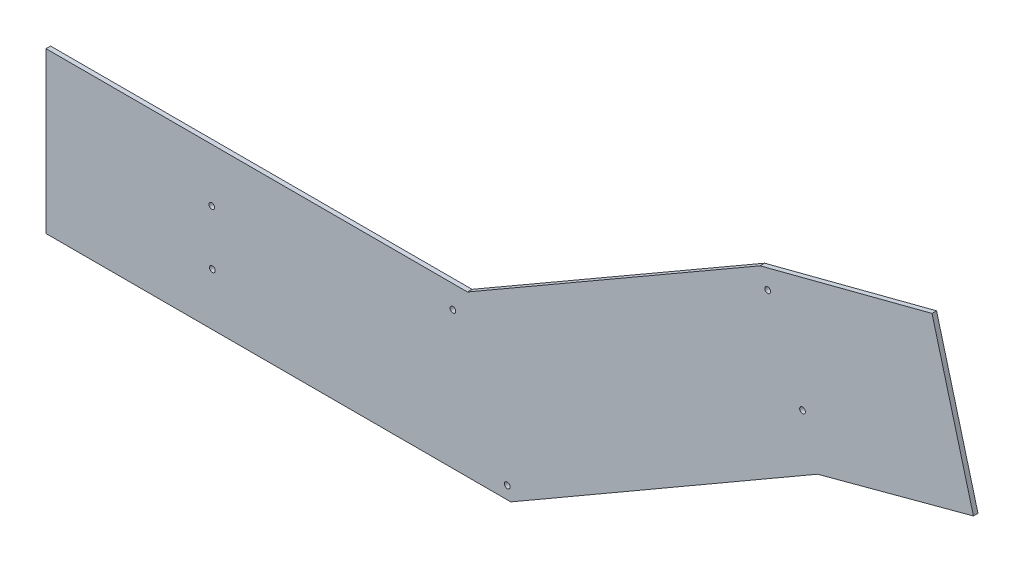
from build123d import *

# Parameters (mm, degrees)
MODEL_R            = 1
BOSS_EXTRU_1_DEPTH = 1.6


with BuildPart() as part:
    # Model → Boss.-Extru.1 (new body)
    with BuildSketch(Plane.XY):
        Polygon((98.150595456, 11.331634302), (152.811395456, 25.971686302), (138.282595456, 80.221514302), (78.010935456, 64.541586302), (-24.588554544, 5.301674302), (-151.608757489, 5.292943326), (-172.373873722, 5.291515997), (-172.373873722, -50.687645053), (-172.373873722, -50.858487698), (-9.398592544, -50.858487698), align=None)
        with Locations((-114.030844544, -32.493525698)):
            Circle(MODEL_R, mode=Mode.SUBTRACT)
        with Locations((-10.652844544, -46.438125698)):
            Circle(MODEL_R, mode=Mode.SUBTRACT)
        with Locations((-114.259444544, -13.418125698)):
            Circle(MODEL_R, mode=Mode.SUBTRACT)
        with Locations((-29.702844544, -2.648525698)):
            Circle(MODEL_R, mode=Mode.SUBTRACT)
        with Locations((92.877555456, 28.085474302)):
            Circle(MODEL_R, mode=Mode.SUBTRACT)
        with Locations((80.685555456, 58.489274302)):
            Circle(MODEL_R, mode=Mode.SUBTRACT)
    extrude(amount=BOSS_EXTRU_1_DEPTH)


solid = part.part
